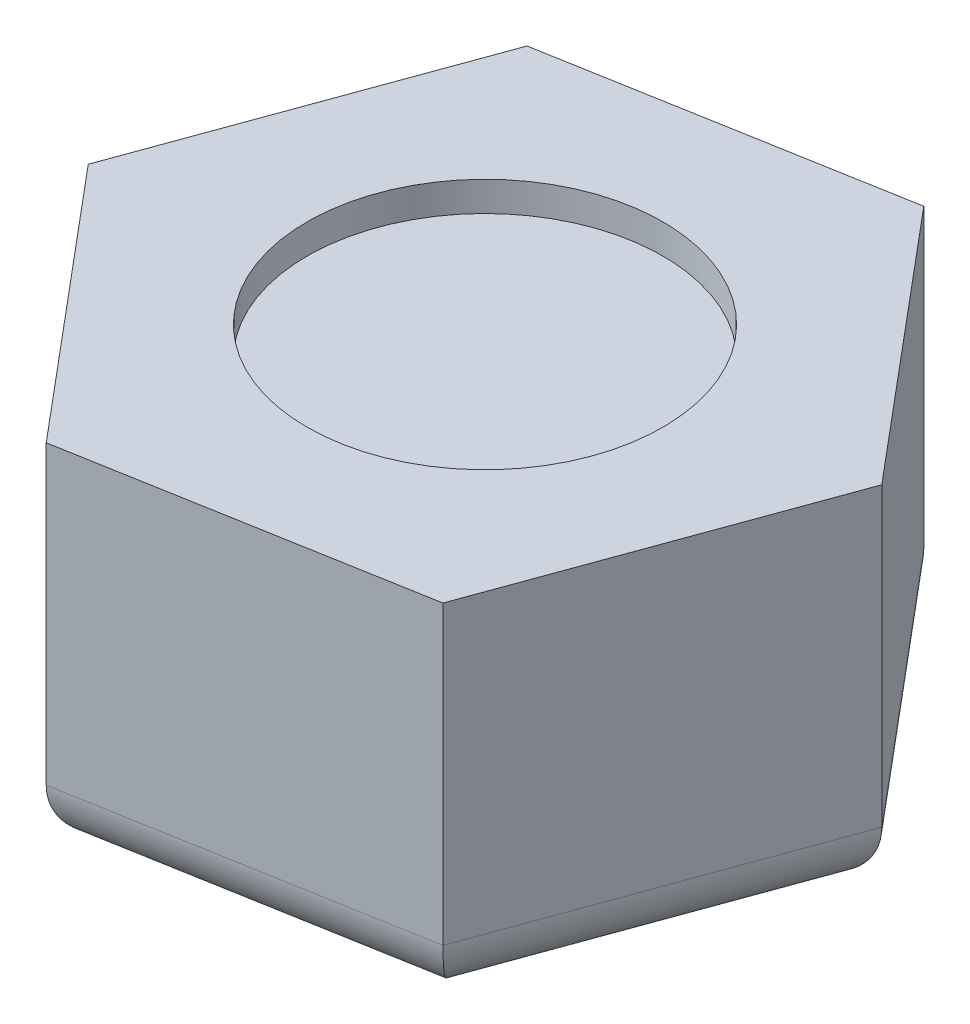
from build123d import *

# Parameters (mm, degrees)
BOSS_EXTRUDE2_DEPTH = 6000
FILLET2_R           = 1000
SKETCH4_R           = 3000
CUT_EXTRUDE2_DEPTH  = 500


with BuildPart() as part:
    # Sketch1 → Boss-Extrude2 (new body)
    with BuildSketch(Plane(origin=(0, 0, 0), x_dir=(1, 0, 0), z_dir=(0, 1, 0))):
        Polygon((3712.967882418, -4421.221871549), (5685.374397738, 1004.913573835), (1972.40651532, 5426.135445384), (-3712.967882418, 4421.221871549), (-5685.374397738, -1004.913573835), (-1972.40651532, -5426.135445384), align=None)
    extrude(amount=BOSS_EXTRUDE2_DEPTH)

    # Fillet2
    fillet2_edges = [part.edges().sort_by_distance(p)[0] for p in [
        (-3828.890456529, 0, 3215.52450961),
        (-4699.171140078, 0, -1708.154148857),
        (-870.280683549, 0, -4923.678658467),
        (3828.890456529, 0, -3215.52450961),
        (4699.171140078, 0, 1708.154148857),
        (870.280683549, 0, 4923.678658467),
    ]]
    fillet(fillet2_edges, radius=FILLET2_R)

    # Sketch4 → Cut-Extrude2 (cut)
    with BuildSketch(Plane(origin=(0, 6000, 0), x_dir=(1, 0, 0), z_dir=(0, 1, 0))):
        with Locations(Location((0, 0, 0), (0, 0, 270))):
            Circle(SKETCH4_R)
    extrude(amount=-CUT_EXTRUDE2_DEPTH, mode=Mode.SUBTRACT)


solid = part.part
